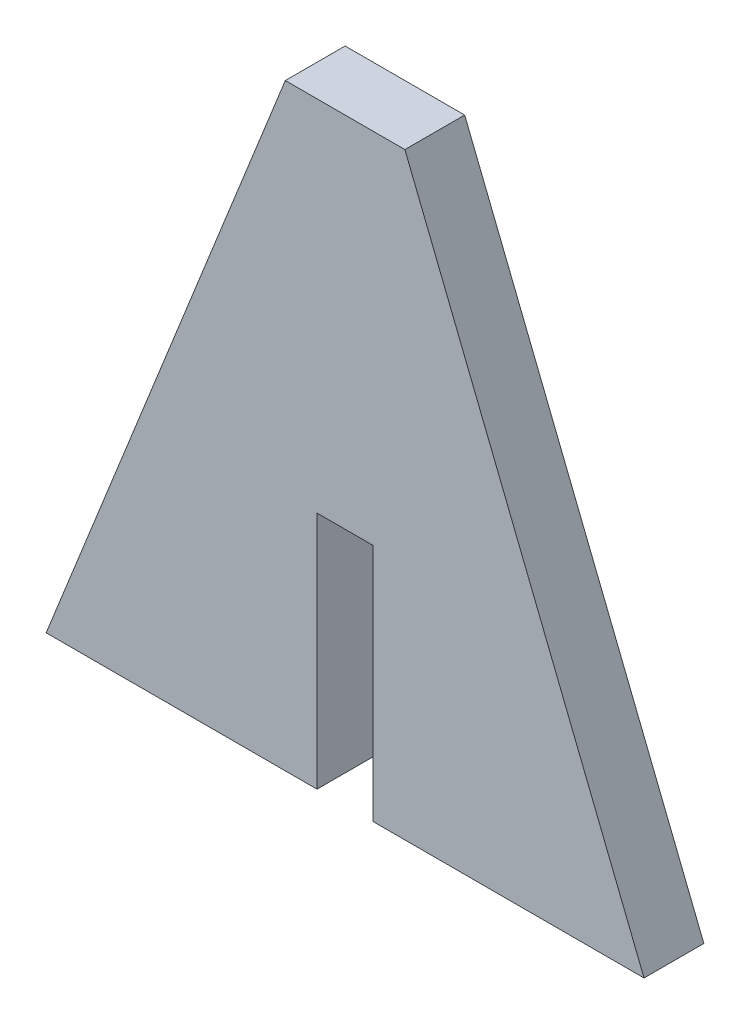
from build123d import *

# Parameters (mm, degrees)
EXTRUDE_1_DEPTH = 5


with BuildPart() as part:
    # 스케치1 → 보스-돌출1 (new body)
    with BuildSketch(Plane.XY):
        Polygon((5, 25), (-5, 25), (-25, -25), (-2.35, -25), (-2.35, -5), (2.35, -5), (2.35, -25), (25, -25), align=None)
    extrude(amount=EXTRUDE_1_DEPTH)


solid = part.part
